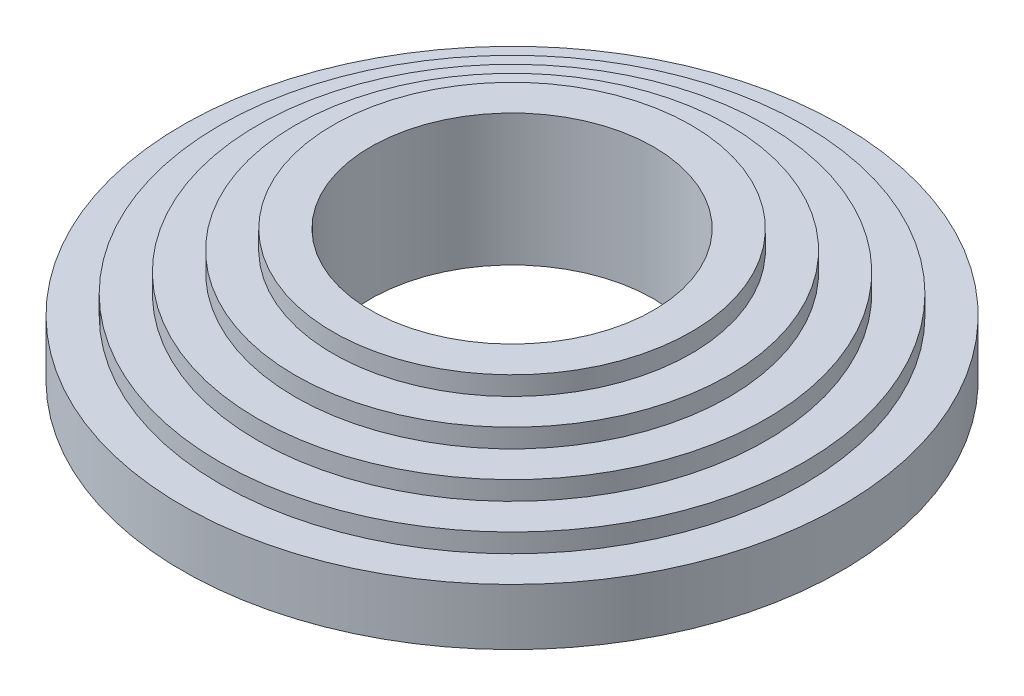
from build123d import *


with BuildPart() as part:
    # Sketch1 → Revolve1 (revolve)
    with BuildSketch(Plane.XY, mode=Mode.PRIVATE) as revolve1_sk:
        Polygon((-44.73399997, 35.097050796), (-36.972, 35.097050796), (-36.972, 38.978050908), (-29.21, 38.978050908), (-29.21, 35.097050796), (-29.21, 11.811050572), (-68.01999988, 11.811050572), (-68.01999988, 23.454050572), (-60.25799991, 23.454050572), (-60.25799991, 27.335050572), (-52.49599994, 27.335050572), (-52.49599994, 31.216050684), (-44.73399997, 31.216050684), align=None)
    revolve(revolve1_sk.sketch.rotate(Axis((0, 0, 0), (0, 1, 0)), 270), axis=Axis((0, 0, 0), (0, 1, 0)))


solid = part.part
